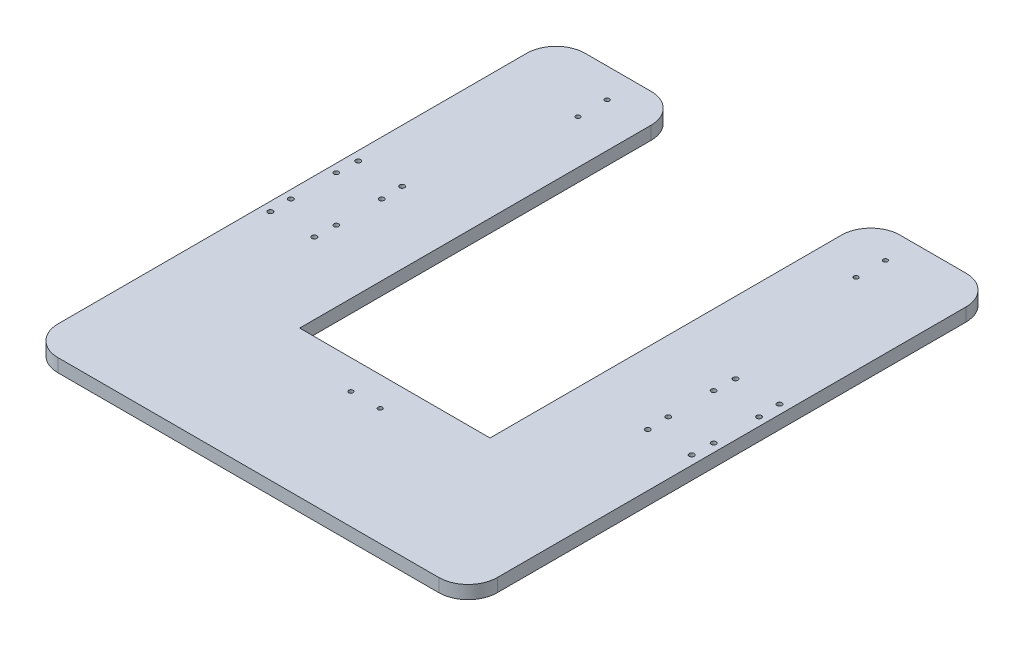
from build123d import *

# Parameters (mm, degrees)
SKETCH_1_W          = 300
SKETCH_1_H          = 360
EXTRUDE_1_DEPTH     = 9
SKETCH_2_W          = 130
SKETCH_2_H          = 260
CUT_EXTRUDE_1_DEPTH = 9
SKETCH_3_R          = 1.5
CUT_EXTRUDE_2_DEPTH = 10
FILLET_1_R          = 20
SKETCH_5_R          = 1.65
SKETCH_5_R_2        = 1.7
CUT_EXTRUDE_4_DEPTH = 10


with BuildPart() as part:
    # 草图1 → 凸台-拉伸1 (new body)
    with BuildSketch(Plane(origin=(0, 0, 0), x_dir=(1, 0, 0), z_dir=(0, 1, 0))):
        Rectangle(SKETCH_1_W, SKETCH_1_H)
    extrude(amount=EXTRUDE_1_DEPTH)

    # 草图2 → 切除-拉伸1 (cut)
    with BuildSketch(Plane(origin=(0, 9, 0), x_dir=(1, 0, 0), z_dir=(0, 1, 0))):
        with Locations((0, 50)):
            Rectangle(SKETCH_2_W, SKETCH_2_H)
    extrude(amount=-CUT_EXTRUDE_1_DEPTH, mode=Mode.SUBTRACT)

    # 草图3 → 切除-拉伸2 (cut)
    with BuildSketch(Plane(origin=(0, 9, 0), x_dir=(1, 0, 0), z_dir=(0, 1, 0))):
        with Locations(Location((-95, 160, 0), (0, 0, 270))):
            Circle(SKETCH_3_R)
        with Locations(Location((-95, 140, 0), (0, 0, 270))):
            Circle(SKETCH_3_R)
        with Locations(Location((95, 140, 0), (0, 0, 270))):
            Circle(SKETCH_3_R)
        with Locations(Location((95, 160, 0), (0, 0, 270))):
            Circle(SKETCH_3_R)
        with Locations(Location((-10, -100, 0), (0, 0, 270))):
            Circle(SKETCH_3_R)
        with Locations(Location((10, -100, 0), (0, 0, 270))):
            Circle(SKETCH_3_R)
    extrude(amount=-CUT_EXTRUDE_2_DEPTH, mode=Mode.SUBTRACT)

    # 圆角1
    fillet_1_edges = [part.edges().sort_by_distance(p)[0] for p in [
        (65, 4.5, -180),
        (-65, 4.5, -180),
        (150, 4.5, 180),
        (-150, 4.5, 180),
        (-150, 4.5, -180),
        (150, 4.5, -180),
    ]]
    fillet(fillet_1_edges, radius=FILLET_1_R)

    # 草图5 → 切除-拉伸4 (cut)
    with BuildSketch(Plane(origin=(0, 9, 0), x_dir=(1, 0, 0), z_dir=(0, 1, 0))):
        with Locations(Location((-113.35, 24.35, 0), (0, 0, 270))):
            Circle(SKETCH_5_R)
        with Locations(Location((-144.35, 24.35, 0), (0, 0, 270))):
            Circle(SKETCH_5_R)
        with Locations(Location((-143.85, 38.85, 0), (0, 0, 270))):
            Circle(SKETCH_5_R_2)
        with Locations(Location((-113.85, 38.85, 0), (0, 0, 270))):
            Circle(SKETCH_5_R_2)
        with Locations(Location((-144.35, -6.65, 0), (0, 0, 270))):
            Circle(SKETCH_5_R)
        with Locations(Location((-143.85, -21.15, 0), (0, 0, 270))):
            Circle(SKETCH_5_R_2)
        with Locations(Location((-113.85, -21.15, 0), (0, 0, 270))):
            Circle(SKETCH_5_R_2)
        with Locations(Location((-113.35, -6.65, 0), (0, 0, 270))):
            Circle(SKETCH_5_R)
    cut_extrude_4 = extrude(amount=-CUT_EXTRUDE_4_DEPTH, mode=Mode.SUBTRACT)

    # 镜向2: 切除-拉伸4 across plane
    add(cut_extrude_4.mirror(Plane(origin=(0, 0, 0), x_dir=(0, 0, 1), z_dir=(1, 0, 0))), mode=Mode.SUBTRACT)


solid = part.part
